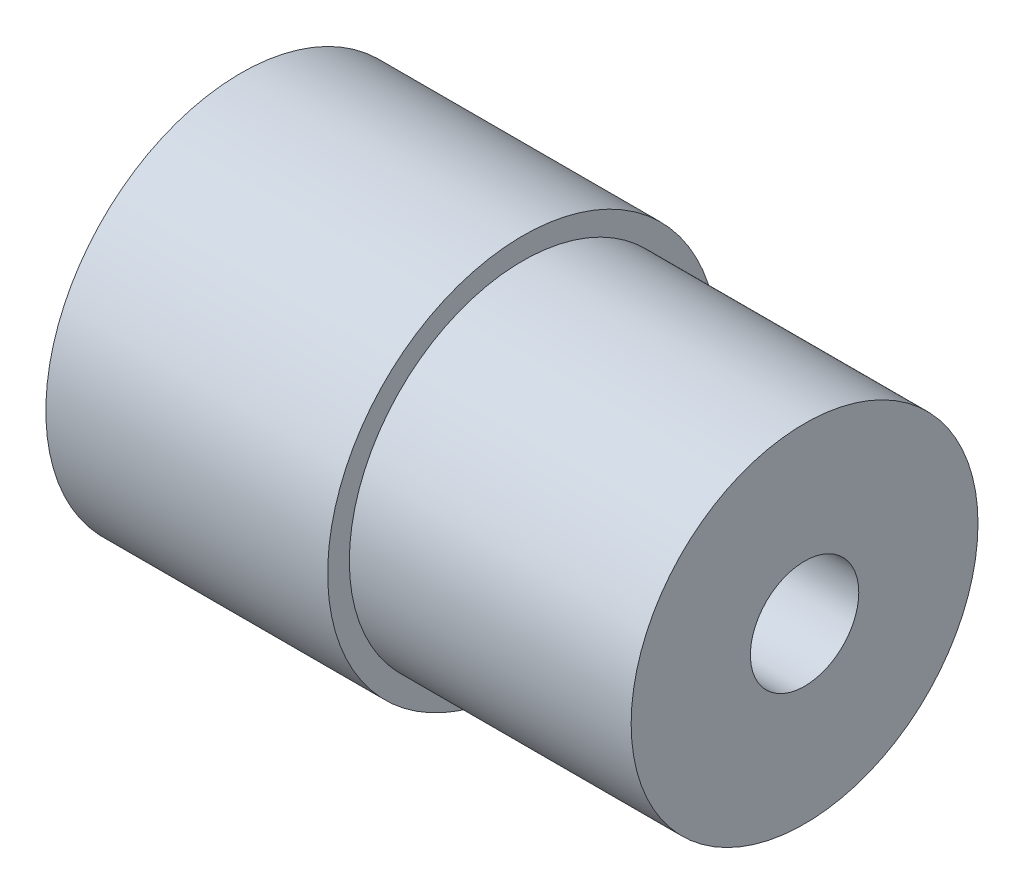
from build123d import *

# Parameters (mm, degrees)
ESQUISSE2_R             = 2.5
ENL_V_MAT_EXTRU_1_DEPTH = 29.948229652
ESQUISSE3_R             = 4
ENL_V_MAT_EXTRU_2_DEPTH = 8
ESQUISSE4_R             = 1.5
ENL_V_MAT_EXTRU_3_DEPTH = 29.948229652


with BuildPart() as part:
    # Esquisse1 → Révolution1 (revolve)
    with BuildSketch(Plane.XY, mode=Mode.PRIVATE) as r_volution1_sk:
        Polygon((0, 0), (0, 8), (-13, 8), (-13, 9), (-26, 9), (-26, 0), align=None)
    revolve(r_volution1_sk.sketch.rotate(Axis((0, 0, 0), (-1, 0, 0)), 90), axis=Axis((0, 0, 0), (-1, 0, 0)))

    # Esquisse2 → Enlèv. mat.-Extru.1 (cut, through all)
    with BuildSketch(Plane(origin=(0, 0, 0), x_dir=(0, 0, -1), z_dir=(1, 0, 0))):
        Circle(ESQUISSE2_R)
    extrude(amount=-ENL_V_MAT_EXTRU_1_DEPTH, mode=Mode.SUBTRACT)

    # Esquisse3 → Enlèv. mat.-Extru.2 (cut)
    with BuildSketch(Plane.ZY.offset(26)):
        Circle(ESQUISSE3_R)
    extrude(amount=-ENL_V_MAT_EXTRU_2_DEPTH, mode=Mode.SUBTRACT)

    # Esquisse4 → Enlèv. mat.-Extru.3 (cut, through all)
    with BuildSketch(Plane(origin=(0, 0, 0), x_dir=(1, 0, 0), z_dir=(0, 1, 0))):
        with Locations(Location((-20, 0, 0), (0, 0, 270))):
            Circle(ESQUISSE4_R)
        with Locations(Location((-6, 0, 0), (0, 0, 270))):
            Circle(ESQUISSE4_R)
    extrude(amount=-ENL_V_MAT_EXTRU_3_DEPTH, mode=Mode.SUBTRACT)


solid = part.part
